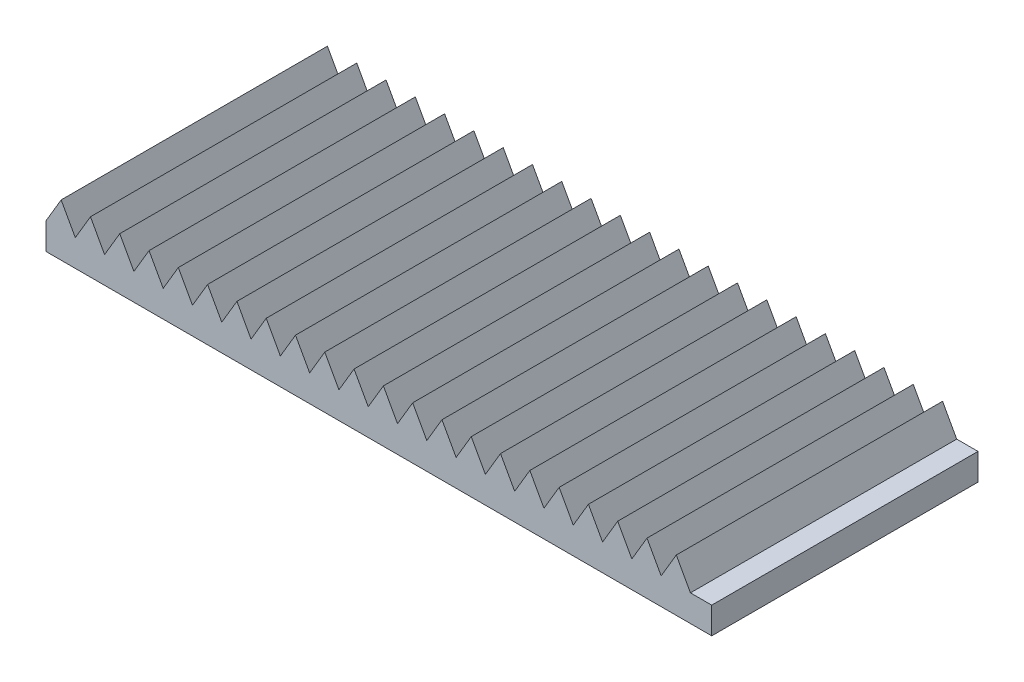
from build123d import *

# Parameters (mm, degrees)
BOSS_EXTRUDE2_DEPTH = 10


with BuildPart() as part:
    # Sketch1 → Boss-Extrude2 (new body)
    with BuildSketch(Plane.XY):
        Polygon((-14.232209738, -0.404494382), (-13.66259275, 0.560186997), (-13.131340021, -0.403021464), (-12.56259275, 0.560186997), (-12.031340021, -0.403021464), (-11.46259275, 0.560186997), (-10.931340021, -0.403021464), (-10.36259275, 0.560186997), (-9.831340021, -0.403021464), (-9.26259275, 0.560186997), (-8.731340021, -0.403021464), (-8.16259275, 0.560186997), (-7.631340021, -0.403021464), (-7.06259275, 0.560186997), (-6.531340021, -0.403021464), (-5.96259275, 0.560186997), (-5.431340021, -0.403021464), (-4.86259275, 0.560186997), (-4.331340021, -0.403021464), (-3.76259275, 0.560186997), (-3.231340021, -0.403021464), (-2.66259275, 0.560186997), (-2.131340021, -0.403021464), (-1.56259275, 0.560186997), (-1.031340021, -0.403021464), (-0.46259275, 0.560186997), (0.068659979, -0.403021464), (0.63740725, 0.560186997), (1.168659979, -0.403021464), (1.73740725, 0.560186997), (2.268659979, -0.403021464), (2.83740725, 0.560186997), (3.368659979, -0.403021464), (3.93740725, 0.560186997), (4.468659979, -0.403021464), (5.03740725, 0.560186997), (5.568659979, -0.403021464), (6.13740725, 0.560186997), (6.668659979, -0.403021464), (7.23740725, 0.560186997), (7.768659979, -0.403021464), (8.33740725, 0.560186997), (8.868659979, -0.403021464), (9.43740725, 0.560186997), (9.969472359, -0.404494382), (10.767790262, -0.404494382), (10.767790262, -1.404494382), (-14.232209738, -1.404494382), align=None)
    extrude(amount=BOSS_EXTRUDE2_DEPTH)


solid = part.part
